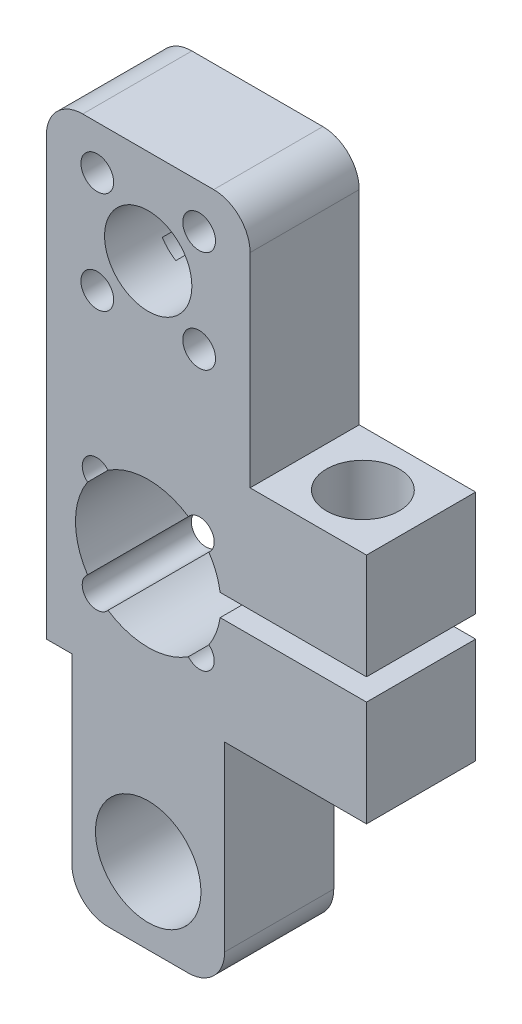
from build123d import *

# Parameters (mm, degrees)
SKETCH_1_R          = 2.25
SKETCH_1_R_2        = 6
SKETCH_1_R_3        = 7.25
EXTRUDE_1_DEPTH     = 15
SKETCH_2_R          = 4.25
CUT_EXTRUDE_2_DEPTH = 8
SKETCH_3_R          = 3.4
CUT_EXTRUDE_3_DEPTH = 1188.655030604
SKETCH_4_R          = 5
CUT_EXTRUDE_4_DEPTH = 15


with BuildPart() as part:
    # 草图1 → 拉伸1 (new body)
    with BuildSketch(Plane.XY):
        with BuildLine():
            Line((1164.940753882, 1110.911631895), (1146.940753882, 1110.911631895))
            ThreePointArc((1146.940753882, 1110.911631895), (1143.405219976, 1109.4471658), (1141.940753882, 1105.911631895))
            Line((1141.940753882, 1105.911631895), (1141.940753882, 1045.911631895))
            Line((1141.940753882, 1045.911631895), (1145.440753882, 1045.911631895))
            Line((1145.440753882, 1045.911631895), (1145.440753882, 1020.911631895))
            ThreePointArc((1145.440753882, 1020.911631895), (1146.905219976, 1017.376097989), (1150.440753882, 1015.911631895))
            Line((1150.440753882, 1015.911631895), (1161.440753882, 1015.911631895))
            ThreePointArc((1161.440753882, 1015.911631895), (1164.976287788, 1017.376097989), (1166.440753882, 1020.911631895))
            Line((1166.440753882, 1020.911631895), (1166.440753882, 1045.911631895))
            Line((1166.440753882, 1045.911631895), (1185.940753882, 1045.911631895))
            Line((1185.940753882, 1045.911631895), (1185.940753882, 1060.411631895))
            Line((1185.940753882, 1060.411631895), (1165.827613848, 1060.411631895))
            ThreePointArc((1165.827613848, 1060.411631895), (1165.271903508, 1058.315850107), (1164.277525065, 1056.389110167))
            ThreePointArc((1164.277525065, 1056.389110167), (1164.426035256, 1053.42635052), (1161.46327561, 1053.574860711))
            ThreePointArc((1161.46327561, 1053.574860711), (1155.940753882, 1051.911631895), (1150.418232154, 1053.574860711))
            ThreePointArc((1150.418232154, 1053.574860711), (1147.455472508, 1053.42635052), (1147.603982698, 1056.389110167))
            ThreePointArc((1147.603982698, 1056.389110167), (1145.940753882, 1061.911631895), (1147.603982698, 1067.434153622))
            ThreePointArc((1147.603982698, 1067.434153622), (1147.455472508, 1070.396913269), (1150.418232154, 1070.248403078))
            ThreePointArc((1150.418232154, 1070.248403078), (1155.940753882, 1071.911631895), (1161.46327561, 1070.248403078))
            ThreePointArc((1161.46327561, 1070.248403078), (1164.426035256, 1070.396913269), (1164.277525065, 1067.434153622))
            ThreePointArc((1164.277525065, 1067.434153622), (1165.271903508, 1065.507413682), (1165.827613848, 1063.411631895))
            Line((1165.827613848, 1063.411631895), (1185.940753882, 1063.411631895))
            Line((1185.940753882, 1063.411631895), (1185.940753882, 1077.911631895))
            Line((1185.940753882, 1077.911631895), (1169.940753882, 1077.911631895))
            Line((1169.940753882, 1077.911631895), (1169.940753882, 1105.911631895))
            ThreePointArc((1169.940753882, 1105.911631895), (1168.476287788, 1109.4471658), (1164.940753882, 1110.911631895))
        make_face()
        with Locations((1162.940753882, 1104.911631895)):
            Circle(SKETCH_1_R, mode=Mode.SUBTRACT)
        with Locations((1155.940753882, 1097.911631895)):
            Circle(SKETCH_1_R_2, mode=Mode.SUBTRACT)
        with Locations((1148.940753882, 1104.911631895)):
            Circle(SKETCH_1_R, mode=Mode.SUBTRACT)
        with Locations((1148.940753882, 1090.911631895)):
            Circle(SKETCH_1_R, mode=Mode.SUBTRACT)
        with Locations((1162.940753882, 1090.911631895)):
            Circle(SKETCH_1_R, mode=Mode.SUBTRACT)
        with Locations((1155.940753882, 1026.411631895)):
            Circle(SKETCH_1_R_3, mode=Mode.SUBTRACT)
    extrude(amount=EXTRUDE_1_DEPTH)

    # 草图2 → 拉伸2 (cut)
    with BuildSketch(Plane(origin=(0, 0, 0), x_dir=(-1, 0, 0), z_dir=(0, 0, -1))):
        with Locations((-1148.940753882, 1090.911631895)):
            Circle(SKETCH_2_R)
        with Locations((-1162.940753882, 1090.911631895)):
            Circle(SKETCH_2_R)
        with Locations((-1148.940753882, 1104.911631895)):
            Circle(SKETCH_2_R)
        with Locations((-1162.940753882, 1104.911631895)):
            Circle(SKETCH_2_R)
    extrude(amount=-CUT_EXTRUDE_2_DEPTH, mode=Mode.SUBTRACT)

    # 草图3 → 拉伸3 (cut, through all)
    with BuildSketch(Plane(origin=(0, 1077.911631895, 0), x_dir=(1, 0, 0), z_dir=(0, 1, 0))):
        with Locations(Location((1177.940753882, -7.5, 0), (0, 0, 270))):
            Circle(SKETCH_3_R)
    extrude(amount=-CUT_EXTRUDE_3_DEPTH, mode=Mode.SUBTRACT)

    # 草图4 → 拉伸4 (cut)
    with BuildSketch(Plane(origin=(0, 1077.911631895, 0), x_dir=(1, 0, 0), z_dir=(0, 1, 0))):
        with Locations(Location((1177.940753882, -7.5, 0), (0, 0, 270))):
            Circle(SKETCH_4_R)
    extrude(amount=-CUT_EXTRUDE_4_DEPTH, mode=Mode.SUBTRACT)


solid = part.part
